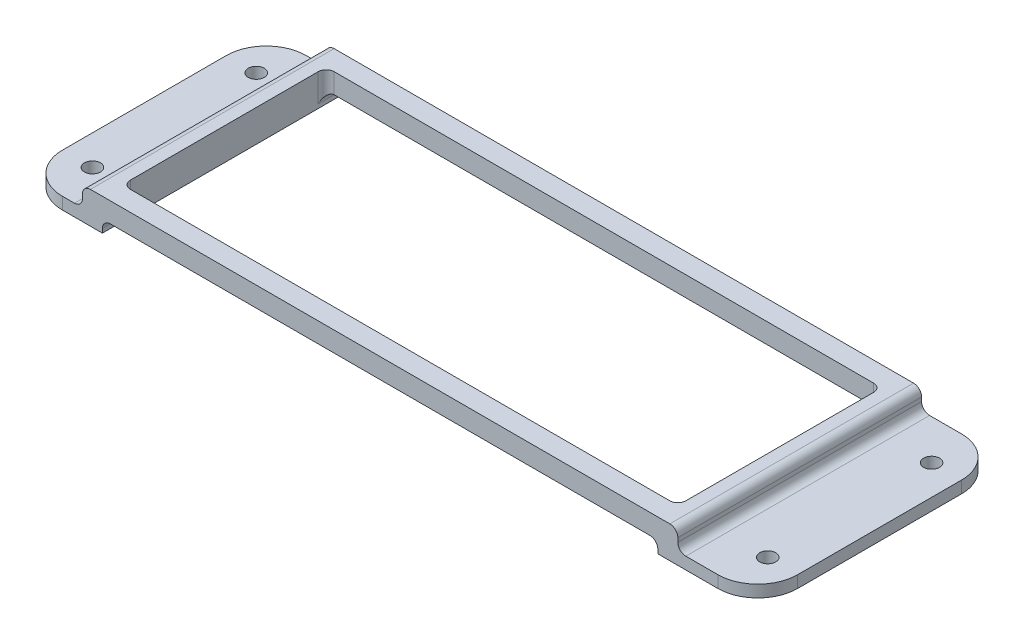
from build123d import *

# Parameters (mm, degrees)
SKETCH1_W             = 25
SKETCH1_H             = 61
SKETCH1_R             = 2
BOSS_EXTRUDE1_DEPTH   = 3
SKETCH1_W_2           = 20
BOSS_EXTRUDE1_2_DEPTH = 3
SKETCH3_W             = 5
SKETCH3_H             = 61
BOSS_EXTRUDE2_DEPTH   = 5
SKETCH4_W             = 5
SKETCH4_H             = 5
BOSS_EXTRUDE3_DEPTH   = 139
FILLET1_R             = 10
FILLET2_R             = 2


with BuildPart() as part:
    # Sketch1 → Boss-Extrude1 (new body)
    with BuildSketch(Plane(origin=(0, 0, 0), x_dir=(1, 0, 0), z_dir=(0, 1, 0))):
        with Locations((171.5, 30.5)):
            Rectangle(SKETCH1_W, SKETCH1_H)
        with Locations(Location((176.5, 10, 0), (0, 0, 90))):
            Circle(SKETCH1_R, mode=Mode.SUBTRACT)
        with Locations(Location((176.5, 51, 0), (0, 0, 270))):
            Circle(SKETCH1_R, mode=Mode.SUBTRACT)
    extrude(amount=BOSS_EXTRUDE1_DEPTH)



with BuildPart() as body_2:
    # Sketch1 → Boss-Extrude1 2 (new body)
    with BuildSketch(Plane(origin=(0, 0, 0), x_dir=(1, 0, 0), z_dir=(0, 1, 0))):
        with Locations((10, 30.5)):
            Rectangle(SKETCH1_W_2, SKETCH1_H)
        with Locations(Location((7.5, 10, 0), (0, 0, 270))):
            Circle(SKETCH1_R, mode=Mode.SUBTRACT)
        with Locations(Location((7.5, 51, 0), (0, 0, 90))):
            Circle(SKETCH1_R, mode=Mode.SUBTRACT)
    extrude(amount=BOSS_EXTRUDE1_2_DEPTH)


with BuildPart() as part_1:
    add(part.part)

    add(body_2.part)  # Boss-Extrude2 merges body 2
    # Sketch3 → Boss-Extrude2 (add)
    with BuildSketch(Plane(origin=(0, 3, 0), x_dir=(1, 0, 0), z_dir=(0, 1, 0))):
        with Locations((17.5, 30.5)):
            Rectangle(SKETCH3_W, SKETCH3_H)
        with Locations((161.5, 30.5)):
            Rectangle(SKETCH3_W, SKETCH3_H)
    extrude(amount=BOSS_EXTRUDE2_DEPTH)

    # Sketch4 → Boss-Extrude3 (add)
    with BuildSketch(Plane(origin=(20, 0, 0), x_dir=(0, 0, -1), z_dir=(1, 0, 0))):
        with Locations((2.5, 5.5)):
            Rectangle(SKETCH4_W, SKETCH4_H)
        with Locations((58.5, 5.5)):
            Rectangle(SKETCH4_W, SKETCH4_H)
    extrude(amount=BOSS_EXTRUDE3_DEPTH)

    # Fillet1
    fillet1_edges = [part_1.edges().sort_by_distance(p)[0] for p in [
        (184, 1.5, 0),
        (184, 1.5, -61),
        (0, 1.5, 0),
        (0, 1.5, -61),
    ]]
    fillet(fillet1_edges, radius=FILLET1_R)

    # Fillet2
    fillet2_edges = [part_1.edges().sort_by_distance(p)[0] for p in [
        (15, 3, -30.5),
        (15, 8, -30.5),
        (20, 3, -2.5),
        (20, 5.5, -5),
        (159, 3, -2.5),
        (159, 5.5, -5),
        (164, 3, -30.5),
        (164, 8, -30.5),
        (20, 5.5, -56),
        (20, 3, -58.5),
        (159, 3, -58.5),
        (159, 5.5, -56),
    ]]
    fillet(fillet2_edges, radius=FILLET2_R)


solid = part_1.part
